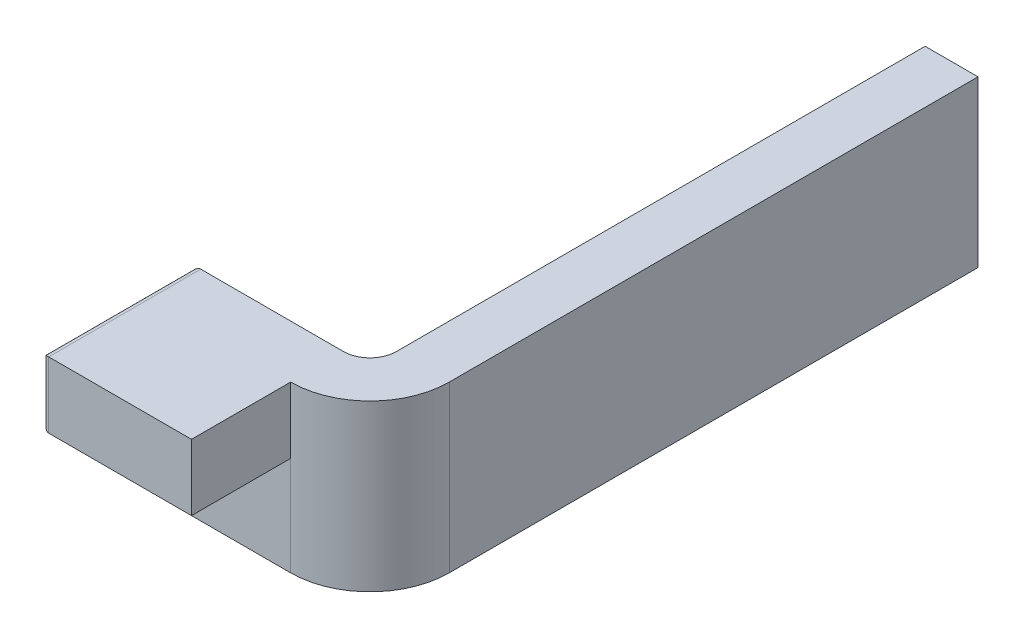
from build123d import *

# Parameters (mm, degrees)
EXTRUDE_1_DEPTH = 25
SKETCH_2_W      = 22.6
SKETCH_2_H      = 10
EXTRUDE_2_DEPTH = 15
FILLET_1_R      = 1


with BuildPart() as part:
    # 草图1 → 凸台-拉伸1 (new body)
    with BuildSketch(Plane(origin=(0, 0, 0), x_dir=(1, 0, 0), z_dir=(0, 1, 0))):
        with BuildLine():
            Line((0, 0), (22.6, 0))
            ThreePointArc((22.6, 0), (25.428427125, 1.171572875), (26.6, 4))
            Line((26.6, 4), (26.6, 84))
            Line((26.6, 84), (34.6, 84))
            Line((34.6, 84), (34.6, 4))
            ThreePointArc((34.6, 4), (31.085281374, -4.485281374), (22.6, -8))
            Line((22.6, -8), (0, -8))
            Line((0, -8), (0, 0))
        make_face()
    extrude(amount=EXTRUDE_1_DEPTH)

    # 草图2 → 凸台-拉伸2 (add)
    with BuildSketch(Plane.XY.offset(8)):
        with Locations((11.3, 20)):
            Rectangle(SKETCH_2_W, SKETCH_2_H)
    extrude(amount=EXTRUDE_2_DEPTH)

    # 圆角1
    fillet_1_edges = [part.edges().sort_by_distance(p)[0] for p in [
        (0, 25, 11.5),
        (0, 12.5, 0),
        (0, 7.5, 8),
        (0, 15, 15.5),
        (0, 20, 23),
    ]]
    fillet(fillet_1_edges, radius=FILLET_1_R)


solid = part.part
